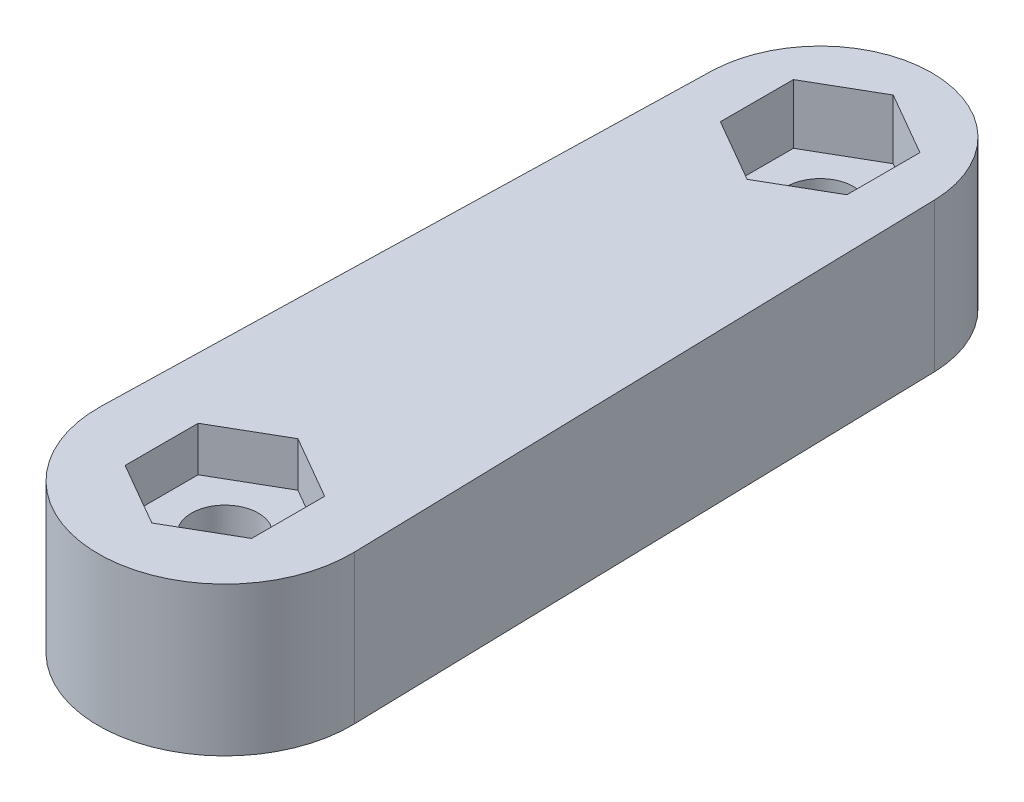
from build123d import *

# Parameters (mm, degrees)
SKETCH1_R           = 1.125
BOSS_EXTRUDE1_DEPTH = 5
SKETCH2_R           = 1.125
CUT_EXTRUDE1_DEPTH  = 2
CUT_EXTRUDE2_START  = -5
CUT_EXTRUDE2_DEPTH  = 1.5
CUT_EXTRUDE3_START  = -5
CUT_EXTRUDE3_DEPTH  = 2


with BuildPart() as part:
    # Sketch1 → Boss-Extrude1 (new body)
    with BuildSketch(Plane(origin=(0, 0, 0), x_dir=(1, 0, 0), z_dir=(0, 1, 0))):
        with BuildLine():
            ThreePointArc((-4.248671667, 0.10625), (0, -4.25), (4.248671667, 0.10625))
            Line((4.248671667, 0.10625), (3.748827942, 20.09375))
            ThreePointArc((3.748827942, 20.09375), (0, 23.75), (-3.748827942, 20.09375))
            Line((-3.748827942, 20.09375), (-4.248671667, 0.10625))
        make_face()
        with Locations(Location((0, 0, 0), (0, 0, 270))):
            Circle(SKETCH1_R, mode=Mode.SUBTRACT)
        with Locations(Location((0, 20, 0), (0, 0, 270))):
            Circle(SKETCH1_R, mode=Mode.SUBTRACT)
    extrude(amount=BOSS_EXTRUDE1_DEPTH)

    # Sketch2 → Cut-Extrude1 (cut)
    # profile 1 of 2: a face of its own
    with BuildSketch(Plane(origin=(0, 0, 0), x_dir=(1, 0, 0), z_dir=(0, 1, 0))):
        with BuildLine():
            ThreePointArc((2.225, 1.780975856), (-2.689214569, -0.943729304), (2.85, 0))
            ThreePointArc((2.85, 0), (2.689214569, 0.943729304), (2.225, 1.780975856))
        make_face()
        with Locations(Location((0, 0, 0), (0, 0, 90))):
            Circle(SKETCH2_R, mode=Mode.SUBTRACT)
    # profile 2 of 2: a face of its own
    with BuildSketch(Plane(origin=(0, 0, 0), x_dir=(1, 0, 0), z_dir=(0, 1, 0))):
        with BuildLine():
            ThreePointArc((2.225, 1.780975856), (2.689214569, 0.943729304), (2.85, 0))
            Line((2.85, 0), (2.85, 15))
            Line((2.85, 15), (2.225, 15))
            Line((2.225, 15), (2.225, 1.780975856))
        make_face()
    extrude(amount=CUT_EXTRUDE1_DEPTH, mode=Mode.SUBTRACT)

    # Sketch3 → Cut-Extrude2 (cut)
    with BuildSketch(Plane.XZ.offset(CUT_EXTRUDE2_START)):
        Polygon((0, 2.453738644), (-2.125, 1.226869322), (-2.125, -1.226869322), (0, -2.453738644), (2.125, -1.226869322), (2.125, 1.226869322), align=None)
    extrude(amount=CUT_EXTRUDE2_DEPTH, mode=Mode.SUBTRACT)

    # Sketch3<3> → Cut-Extrude3 (cut)
    with BuildSketch(Plane.XZ.offset(CUT_EXTRUDE3_START)):
        Polygon((2.125, -21.226869322), (0, -22.453738644), (-2.125, -21.226869322), (-2.125, -18.773130678), (0, -17.546261356), (2.125, -18.773130678), align=None)
    extrude(amount=CUT_EXTRUDE3_DEPTH, mode=Mode.SUBTRACT)


solid = part.part
